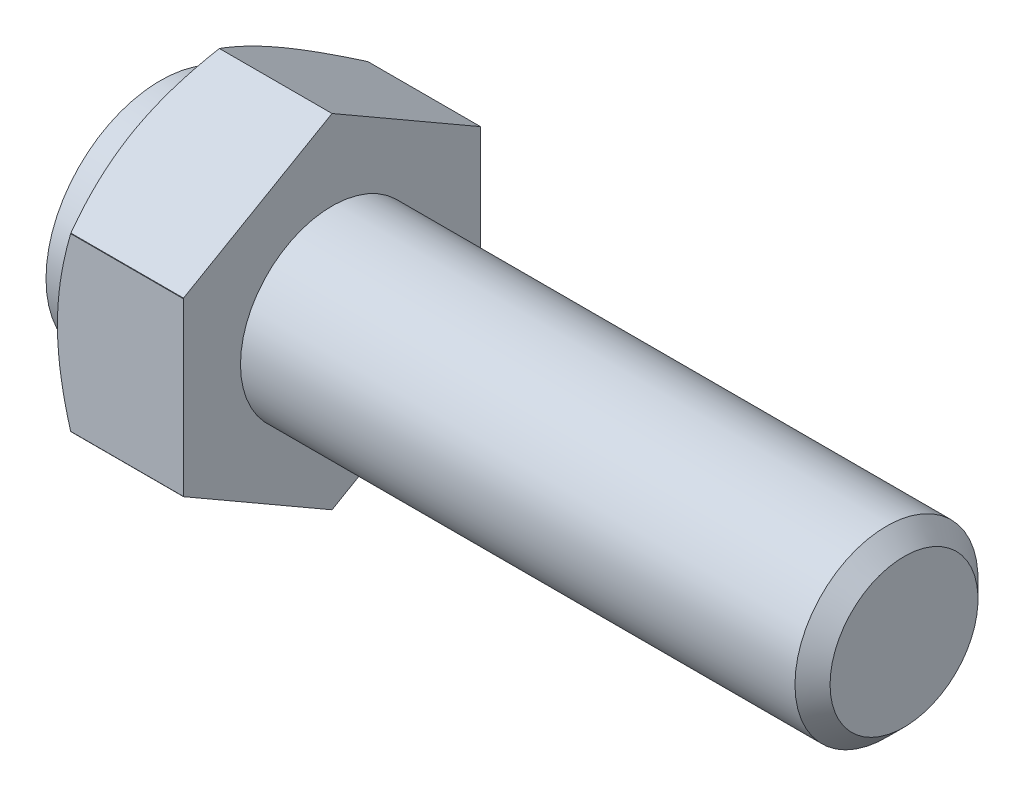
from build123d import *

# Parameters (mm, degrees)
SKETCH_2_W          = 30
SKETCH_2_H          = 30
CUT_EXTRUDE_1_DEPTH = 7.5


with BuildPart() as part:
    # 草图1 → 旋转1 (revolve)
    with BuildSketch(Plane.XY):
        Polygon((-7.5, 0), (-7.5, 5), (-5.5, 5), (-5.5, 6.5), (-4.922649731, 7.5), (0, 7.5), (0, 4), (24.233, 4), (25, 3.233), (25, 0), align=None)
    revolve(axis=Axis((25, 0, 0), (-1, 0, 0)))

    # 草图2 → 切除-拉伸1 (cut)
    with BuildSketch(Plane(origin=(0, 0, 0), x_dir=(0, 0, -1), z_dir=(1, 0, 0))):
        Rectangle(SKETCH_2_W, SKETCH_2_H)
        Polygon((-6.5, 3.75277675), (-6.5, -3.75277675), (0, -7.5), (6.5, -3.75277675), (6.5, 3.75277675), (0, 7.5), align=None, mode=Mode.SUBTRACT)
    extrude(amount=-CUT_EXTRUDE_1_DEPTH, mode=Mode.SUBTRACT)


solid = part.part
